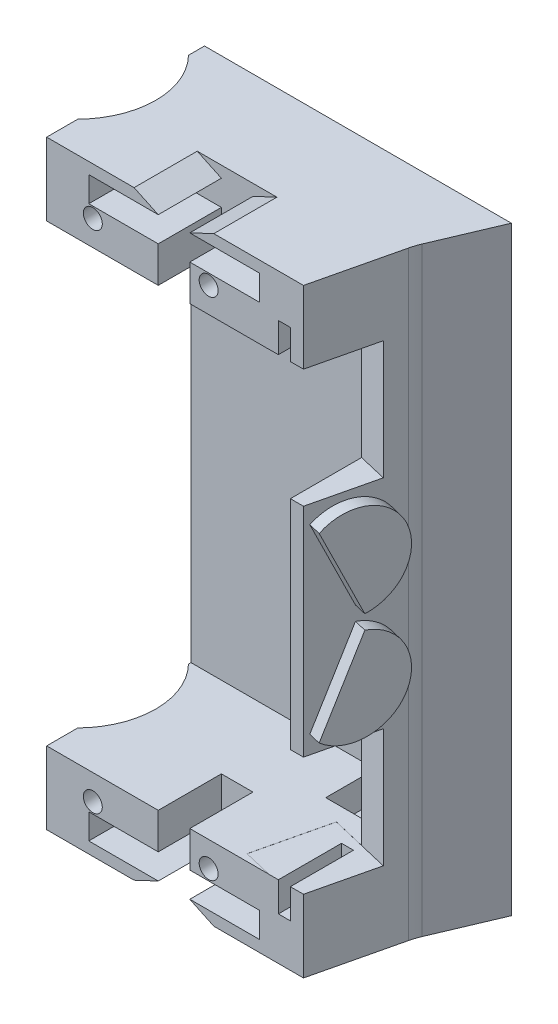
from build123d import *

# Parameters (mm, degrees)
CROQUIS1_W              = 46.6
CROQUIS1_H              = 11.5
CROQUIS1_W_2            = 8
CROQUIS1_H_2            = 72
SALIENTE_EXTRUIR1_DEPTH = 25
CROQUIS3_W              = 30
CROQUIS3_H              = 5
CORTAR_EXTRUIR1_DEPTH   = 100
CROQUIS4_W              = 5
CROQUIS4_H              = 10
CORTAR_EXTRUIR2_DEPTH   = 2000
CORTAR_EXTRUIR3_DEPTH   = 2000
CROQUIS7_W              = 38.34522513
CROQUIS7_H              = 2.150988128
SALIENTE_EXTRUIR2_DEPTH = 90
CROQUIS8_W              = 13.2
CROQUIS8_H              = 10
CORTAR_EXTRUIR4_DEPTH   = 10
SALIENTE_EXTRUIR3_DEPTH = 95
CROQUIS10_R             = 12.5
CORTAR_EXTRUIR5_DEPTH   = 95
SALIENTE_EXTRUIR4_DEPTH = 2
REDONDEO1_R             = 10
CROQUIS13_R             = 1.5
CORTAR_EXTRUIR7_DEPTH   = 5
CROQUIS16_W             = 11.760768102
CROQUIS16_H             = 18.8
CORTAR_EXTRUIR9_DEPTH   = 10
CORTAR_EXTRUIR10_DEPTH  = 10
CROQUIS18_W             = 27
CROQUIS18_H             = 4
CORTAR_EXTRUIR11_DEPTH  = 10
CROQUIS20_R             = 1.5
CORTAR_EXTRUIR12_DEPTH  = 10


with BuildPart() as part:
    # Croquis1 → Saliente-Extruir1 (new body)
    with BuildSketch(Plane.XY):
        with Locations((9.10717527, 8.346927266)):
            Rectangle(CROQUIS1_W, CROQUIS1_H)
        with Locations((28.40717527, -33.403072734)):
            Rectangle(CROQUIS1_W_2, CROQUIS1_H_2)
        Polygon((32.40717527, -80.903072734), (32.40717527, -69.403072734), (24.40717527, -69.403072734), (-14.19282473, -69.403072734), (-14.19282473, -80.903072734), align=None)
    extrude(amount=SALIENTE_EXTRUIR1_DEPTH)

    # Croquis3 → Cortar-Extruir1 (cut)
    with BuildSketch(Plane(origin=(32.40717527, 0, 0), x_dir=(0, 0, -1), z_dir=(1, 0, 0))):
        with Locations((-30, -60.403072734)):
            Rectangle(CROQUIS3_W, CROQUIS3_H)
        with Locations((-30, -6.403072734)):
            Rectangle(CROQUIS3_W, CROQUIS3_H)
    extrude(amount=-CORTAR_EXTRUIR1_DEPTH, mode=Mode.SUBTRACT)

    # Croquis4 → Cortar-Extruir2 (cut)
    with BuildSketch(Plane(origin=(0, -80.903072734, 0), x_dir=(-1, 0, 0), z_dir=(0, -1, 0))):
        with Locations((-5.979621663, -20)):
            Rectangle(CROQUIS4_W, CROQUIS4_H)
    extrude(amount=-CORTAR_EXTRUIR2_DEPTH, mode=Mode.SUBTRACT)

    # Croquis5 → Cortar-Extruir3 (cut)
    with BuildSketch(Plane.XZ.offset(80.903072734)):
        Polygon((32.40717527, 0), (26.484562574, 25), (32.40717527, 25), align=None)
    extrude(amount=-CORTAR_EXTRUIR3_DEPTH, mode=Mode.SUBTRACT)

    # Croquis7 → Saliente-Extruir2 (add)
    with BuildSketch(Plane(origin=(0, 14.096927266, 0), x_dir=(1, 0, 0), z_dir=(0, 1, 0))):
        with Locations((4.979787835, -1.075494064)):
            Rectangle(CROQUIS7_W, CROQUIS7_H)
    extrude(amount=-SALIENTE_EXTRUIR2_DEPTH)

    # Croquis8 → Cortar-Extruir4 (cut)
    with BuildSketch(Plane(origin=(0, 0, 0), x_dir=(-1, 0, 0), z_dir=(0, 0, -1))):
        with Locations((-21.60717527, 2.096927266)):
            Rectangle(CROQUIS8_W, CROQUIS8_H)
        with Locations((-21.60717527, -68.903072734)):
            Rectangle(CROQUIS8_W, CROQUIS8_H)
    extrude(amount=-CORTAR_EXTRUIR4_DEPTH, mode=Mode.SUBTRACT)

    # Croquis9 → Saliente-Extruir3 (add)
    with BuildSketch(Plane.XZ.offset(80.903072734)):
        Polygon((32.40717527, 0), (34.40717527, 0), (29.871577543, 10.70303706), align=None)
    extrude(amount=-SALIENTE_EXTRUIR3_DEPTH)

    # Croquis10 → Cortar-Extruir5 (cut)
    with BuildSketch(Plane.XZ.offset(80.903072734)):
        with Locations((-23.100515524, 11.30775419)):
            Circle(CROQUIS10_R)
    extrude(amount=-CORTAR_EXTRUIR5_DEPTH, mode=Mode.SUBTRACT)

    # Croquis11 → Saliente-Extruir4 (add)
    with BuildSketch(Plane(origin=(30.685017166, 0, 7.26941889), x_dir=(0.2305238801243756, 0, -0.9730666681643158), z_dir=(0.9730666681643156, 0, 0.23052388012437558))):
        with BuildLine():
            Line((-11.378913607, -34.525526143), (-17.390636934, -47.778099529))
            ThreePointArc((-17.390636934, -47.778099529), (-5.898546533, -45.001394179), (-11.378913607, -34.525526143))
        make_face()
        with BuildLine():
            Line((-11.378913607, -32.280619326), (-17.390636934, -19.028045939))
            ThreePointArc((-17.390636934, -19.028045939), (-5.898546533, -21.804751289), (-11.378913607, -32.280619326))
        make_face()
    extrude(amount=SALIENTE_EXTRUIR4_DEPTH)

    # Redondeo1
    redondeo1_edges = [part.edges().sort_by_distance(p)[0] for p in [
        (29.871577543, -33.403072734, 10.70303706),
    ]]
    fillet(redondeo1_edges, radius=REDONDEO1_R)

    # Croquis13 → Cortar-Extruir7 (cut)
    with BuildSketch(Plane(origin=(0, 0, 0), x_dir=(-1, 0, 0), z_dir=(0, 0, -1))):
        with Locations((-18.80717527, -77.903072734)):
            Circle(CROQUIS13_R)
        with Locations((1.89282473, -77.903072734)):
            Circle(CROQUIS13_R)
        with Locations((-29.560114376, -45.103072734)):
            Circle(CROQUIS13_R)
        with Locations((-29.560114376, -21.703072734)):
            Circle(CROQUIS13_R)
        with Locations((-18.80717527, 11.096927266)):
            Circle(CROQUIS13_R)
        with Locations((1.89282473, 11.096927266)):
            Circle(CROQUIS13_R)
    extrude(amount=-CORTAR_EXTRUIR7_DEPTH, mode=Mode.SUBTRACT)

    # Croquis16 → Cortar-Extruir9 (cut)
    with BuildSketch(Plane(origin=(30.685017166, 0, 7.26941889), x_dir=(0.2305238801243756, 0, -0.9730666681643158), z_dir=(0.9730666681643156, 0, 0.23052388012437558))):
        with Locations((-13.601726627, -60.013945982)):
            Rectangle(CROQUIS16_W, CROQUIS16_H)
        with Locations((-13.601726627, -6.792199486)):
            Rectangle(CROQUIS16_W, CROQUIS16_H)
    extrude(amount=-CORTAR_EXTRUIR9_DEPTH, mode=Mode.SUBTRACT)

    # Croquis17 → Cortar-Extruir10 (cut)
    with BuildSketch(Plane.XY.offset(25)):
        Polygon((24.40717527, -69.403072734), (24.40717527, -74.103072734), (22.50717527, -74.103072734), (22.50717527, -69.413945982), align=None)
        Polygon((22.50717527, 2.607800514), (24.40717527, 2.596927266), (24.40717527, 7.296927266), (22.50717527, 7.296927266), align=None)
    extrude(amount=-CORTAR_EXTRUIR10_DEPTH, mode=Mode.SUBTRACT)

    # Croquis18 → Cortar-Extruir11 (cut)
    with BuildSketch(Plane.XY.offset(25)):
        Polygon((3.479621663, -80.903072734), (3.479621663, -79.103072734), (-0.341573642, -80.903072734), align=None)
        Polygon((8.479621663, -80.903072734), (8.457050966, -79.103072734), (12.278246271, -80.903072734), align=None)
        with Locations((5.979621663, 10.296927266)):
            Rectangle(CROQUIS18_W, CROQUIS18_H)
        Polygon((12.278246271, 14.096927266), (8.479621663, 14.096927266), (8.457050966, 12.296927266), align=None)
        with Locations((5.979621663, -77.103072734)):
            Rectangle(CROQUIS18_W, CROQUIS18_H)
        Polygon((3.479621663, 12.296927266), (-0.341573642, 14.096927266), (3.479621663, 14.096927266), align=None)
    extrude(amount=-CORTAR_EXTRUIR11_DEPTH, mode=Mode.SUBTRACT)

    # Croquis20 → Cortar-Extruir12 (cut)
    with BuildSketch(Plane.XY.offset(25)):
        with Locations((11.463707662, -73.403072734)):
            Circle(CROQUIS20_R)
        with Locations((-6.881069151, -73.403072734)):
            Circle(CROQUIS20_R)
        with Locations(Location((11.463707662, 6.596927266, 0), (0, 0, 180))):
            Circle(CROQUIS20_R)
        with Locations(Location((-6.881069151, 6.596927266, 0), (0, 0, 180))):
            Circle(CROQUIS20_R)
    extrude(amount=-CORTAR_EXTRUIR12_DEPTH, mode=Mode.SUBTRACT)


solid = part.part
